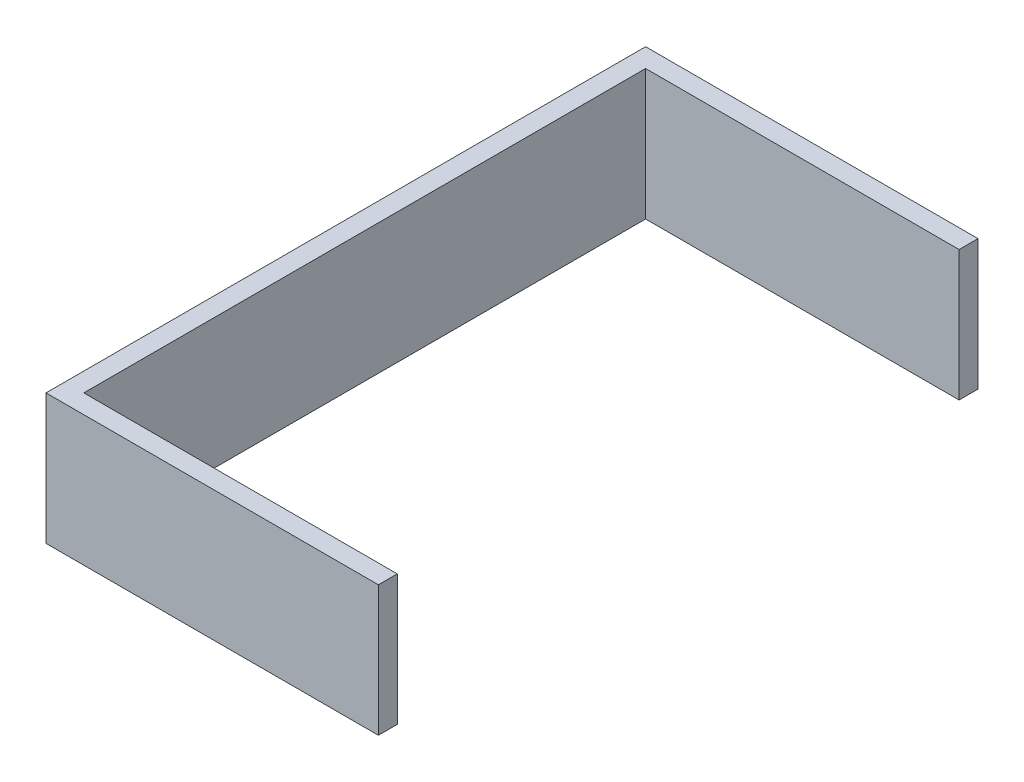
from build123d import *

# Parameters (mm, degrees)
BOSS_EXTRUDE1_DEPTH = 127


with BuildPart() as part:
    # Sketch1 → Boss-Extrude1 (new body)
    with BuildSketch(Plane(origin=(0, 0, 0), x_dir=(1, 0, 0), z_dir=(0, 1, 0))):
        Polygon((0, 18.415), (0, -565.785), (323.85, -565.785), (323.85, -547.37), (18.415, -547.37), (18.415, 0), (323.85, 0), (323.85, 18.415), align=None)
    extrude(amount=BOSS_EXTRUDE1_DEPTH)


solid = part.part
